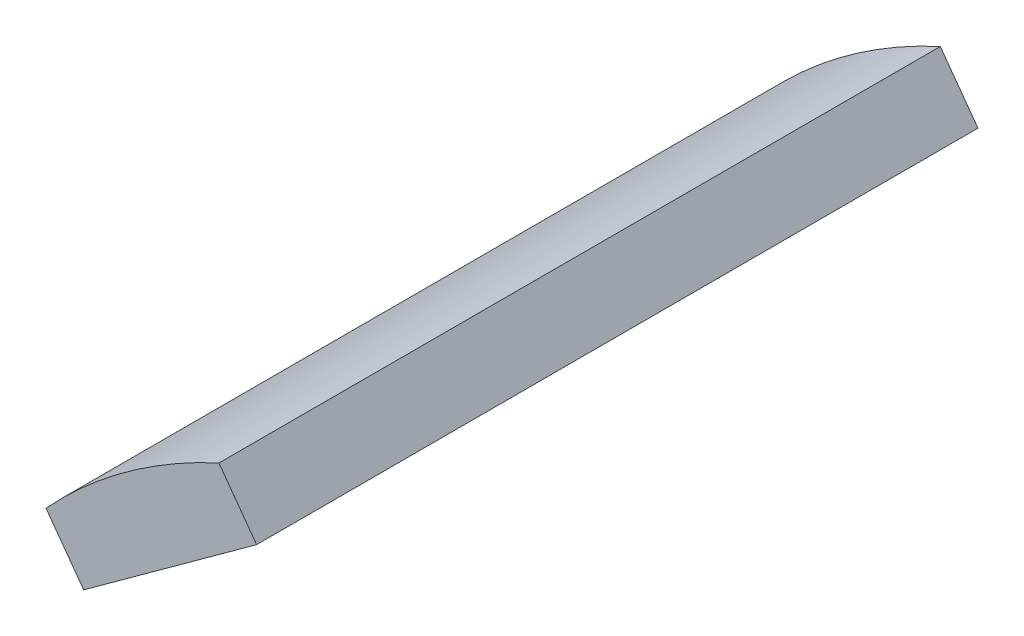
from build123d import *

# Parameters (mm, degrees)
BOSS_EXTRUDE2_DEPTH = 67.5


with BuildPart() as part:
    # Sketch1 → Boss-Extrude2 (new body)
    with BuildSketch(Plane.XY):
        with BuildLine():
            Line((-39.814328118, 71.812737564), (-43.341039632, 76.666839531))
            ThreePointArc((-43.341039632, 76.666839531), (-52.018994828, 71.598004002), (-59.521379519, 64.911134485))
            Line((-59.521379519, 64.911134485), (-55.994668006, 60.057032519))
            Line((-55.994668006, 60.057032519), (-39.814328118, 71.812737564))
        make_face()
    extrude(amount=BOSS_EXTRUDE2_DEPTH)


solid = part.part
